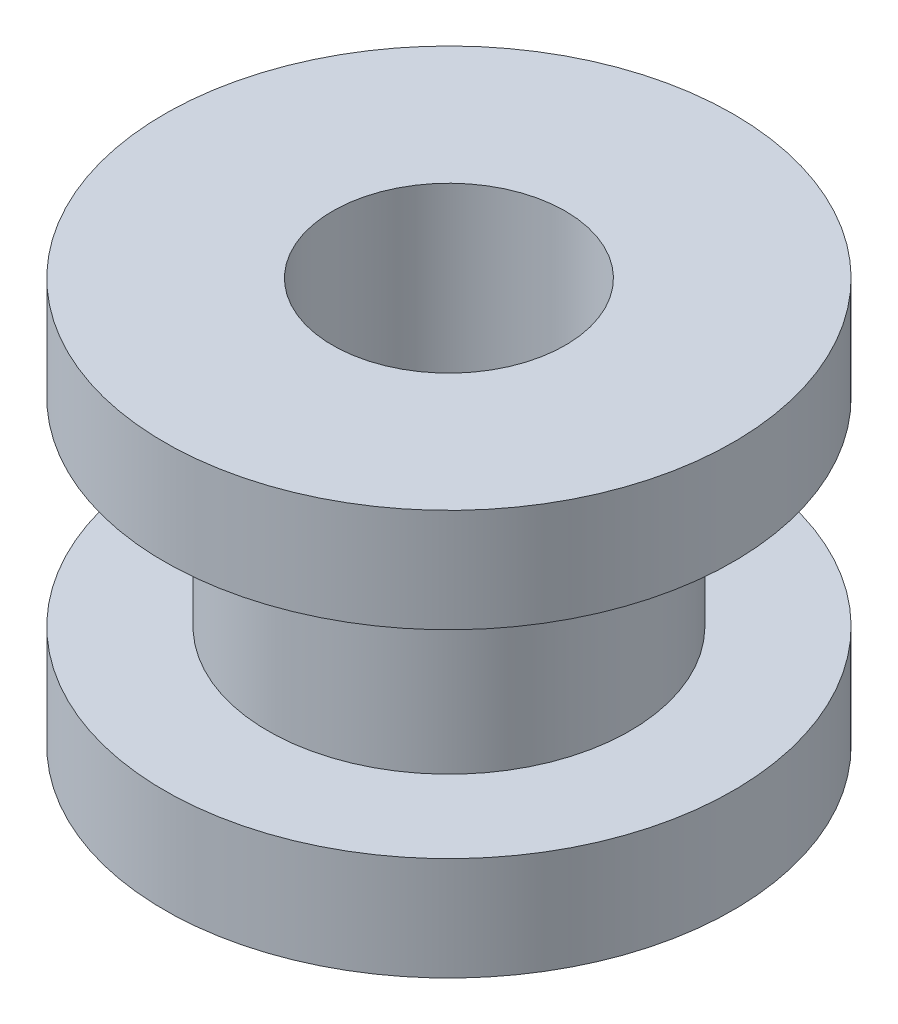
from build123d import *


with BuildPart() as part:
    # 草图1 → 旋转1 (revolve)
    with BuildSketch(Plane.XY):
        Polygon((-1.35, 2.35), (-3.3, 2.35), (-3.3, 1.15), (-2.1, 1.15), (-2.1, -1.15), (-3.3, -1.15), (-3.3, -2.35), (-1.35, -2.35), align=None)
    revolve(axis=Axis((0, 0, 0), (0, 1, 0)))


solid = part.part
